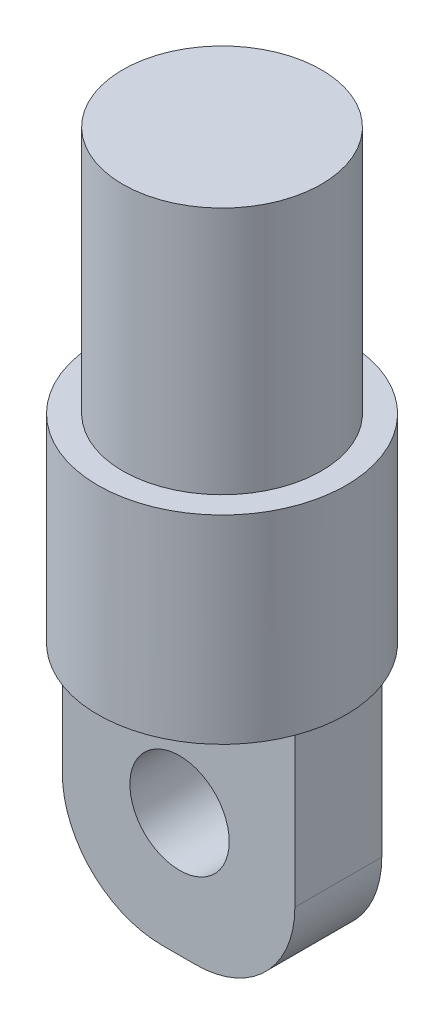
from build123d import *

# Parameters (mm, degrees)
SKETCH1_R           = 31.75
BOSS_EXTRUDE1_DEPTH = 50.8
SKETCH2_R           = 25.4
BOSS_EXTRUDE2_DEPTH = 63.5
SKETCH3_W           = 59.480755442
SKETCH3_H           = 22.232627646
BOSS_EXTRUDE3_DEPTH = 63.5
SKETCH4_R           = 12.7
CUT_EXTRUDE1_DEPTH  = 127.135139278
FILLET1_R           = 25.4
FILLET2_R           = 25.4


with BuildPart() as part:
    # Sketch1 → Boss-Extrude1 (new body)
    with BuildSketch(Plane(origin=(0, 0, 0), x_dir=(1, 0, 0), z_dir=(0, 1, 0))):
        with Locations(Location((0, 0, 0), (0, 0, 270))):
            Circle(SKETCH1_R)
    extrude(amount=BOSS_EXTRUDE1_DEPTH)

    # Sketch2 → Boss-Extrude2 (add)
    with BuildSketch(Plane(origin=(0, 50.8, 0), x_dir=(1, 0, 0), z_dir=(0, 1, 0))):
        with Locations(Location((0, 0, 0), (0, 0, 270))):
            Circle(SKETCH2_R)
    extrude(amount=BOSS_EXTRUDE2_DEPTH)

    # Sketch3 → Boss-Extrude3 (add)
    with BuildSketch(Plane.XZ):
        Rectangle(SKETCH3_W, SKETCH3_H)
    extrude(amount=BOSS_EXTRUDE3_DEPTH)

    # Sketch4 → Cut-Extrude1 (cut, through all)
    with BuildSketch(Plane.XY.offset(11.116313823)):
        with Locations((0.243990196, -31.967064289)):
            Circle(SKETCH4_R)
    extrude(amount=-CUT_EXTRUDE1_DEPTH, mode=Mode.SUBTRACT)

    # Fillet1
    fillet1_edges = [part.edges().sort_by_distance(p)[0] for p in [
        (-29.740377721, -63.5, 0),
    ]]
    fillet(fillet1_edges, radius=FILLET1_R)

    # Fillet2
    fillet2_edges = [part.edges().sort_by_distance(p)[0] for p in [
        (29.740377721, -63.5, 0),
    ]]
    fillet(fillet2_edges, radius=FILLET2_R)


solid = part.part
